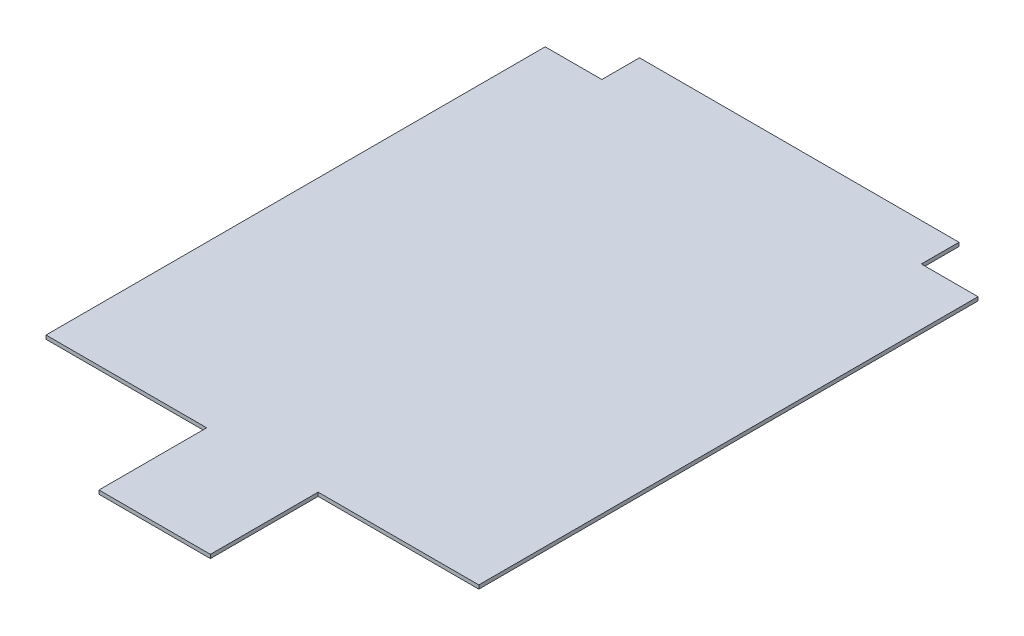
from build123d import *

# Parameters (mm, degrees)
RESSALTO_EXTRUS_O1_DEPTH = 0.5


with BuildPart() as part:
    # Esboço1 → Ressalto-extrusão1 (new, symmetric)
    with BuildSketch(Plane(origin=(0, 0, 0), x_dir=(1, 0, 0), z_dir=(0, 1, 0))):
        Polygon((51.76515993, 74.050984143), (36.51515993, 74.050984143), (36.51515993, 84.183084139), (-6.48484007, 84.183084139), (-49.48484007, 84.183084139), (-49.48484007, 74.050984143), (-64.73484007, 74.050984143), (-64.73484007, 8.933084139), (-64.73484007, -60.318382682), (-21.48484007, -60.318382682), (-21.48484007, -69.817649271), (-21.48484007, -89.316915861), (-6.48484007, -89.316915861), (8.51515993, -89.316915861), (8.51515993, -69.817649271), (8.51515993, -60.318382682), (51.76515993, -60.318382682), (51.76515993, 8.933084139), align=None)
    extrude(amount=RESSALTO_EXTRUS_O1_DEPTH, both=True)


solid = part.part
